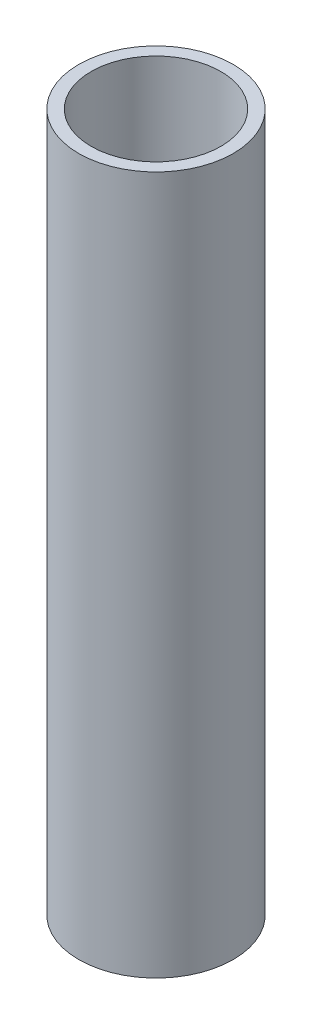
from build123d import *

# Parameters (mm, degrees)
SKETCH1_R           = 12.500000019
SKETCH1_R_2         = 10.499999955
BOSS_EXTRUDE1_DEPTH = 113


with BuildPart() as part:
    # Sketch1 → Boss-Extrude1 (new body)
    with BuildSketch(Plane(origin=(0, 0, 0), x_dir=(1, 0, 0), z_dir=(0, 1, 0))):
        with Locations(Location((0, 0, 0), (0, 0, 270))):
            Circle(SKETCH1_R)
        with Locations(Location((0, 0, 0), (0, 0, 270))):
            Circle(SKETCH1_R_2, mode=Mode.SUBTRACT)
    extrude(amount=BOSS_EXTRUDE1_DEPTH)


solid = part.part
